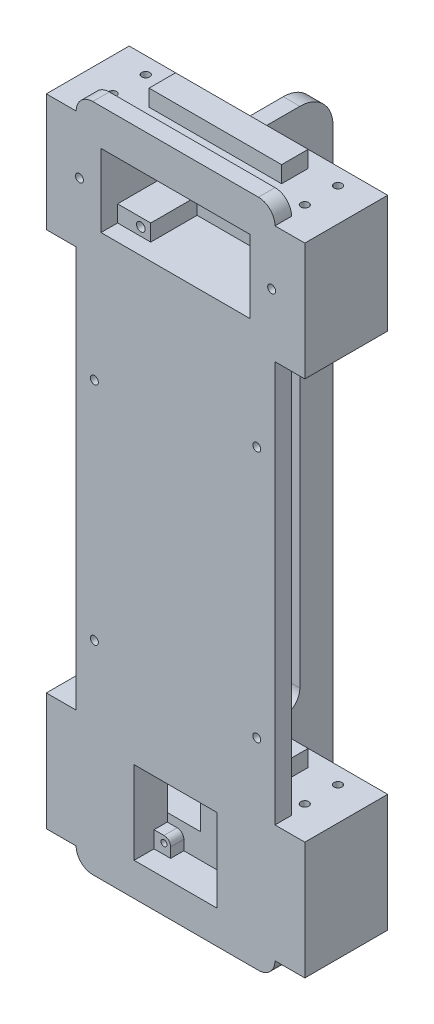
from build123d import *

# Parameters (mm, degrees)
EXTRUDE_1_DEPTH     = 5
SKETCH_3_W          = 78
SKETCH_3_H          = 35.5
EXTRUDE_3_DEPTH     = 25
SKETCH_4_W          = 40
SKETCH_4_H          = 8
EXTRUDE_4_DEPTH     = 5
SKETCH_5_R          = 1.2
CUT_EXTRUDE_1_DEPTH = 210.737222495
SKETCH_6_W          = 40
SKETCH_6_H          = 8
EXTRUDE_5_DEPTH     = 5
EXTRUDE_6_DEPTH     = 2.5
SKETCH_8_W          = 40
SKETCH_8_H          = 8
EXTRUDE_7_DEPTH     = 5
SKETCH_17_W         = 40
SKETCH_17_H         = 8
EXTRUDE_12_DEPTH    = 5
SKETCH_18_W         = 25
SKETCH_18_H         = 25
CUT_EXTRUDE_3_DEPTH = 6
SKETCH_21_R         = 0.9
CUT_EXTRUDE_4_DEPTH = 10
SKETCH_22_R         = 1.2
CUT_EXTRUDE_5_DEPTH = 10
SKETCH_23_W         = 45
SKETCH_23_H         = 22
CUT_EXTRUDE_6_DEPTH = 5
SKETCH_25_R         = 1.3
CUT_EXTRUDE_7_DEPTH = 14
SKETCH_26_W         = 17.5
SKETCH_26_H         = 12
CUT_EXTRUDE_8_DEPTH = 15


with BuildPart() as part:
    # 草图1 → 凸台-拉伸1 (new body)
    with BuildSketch(Plane.XY):
        with BuildLine():
            Line((5, 0), (55, 0))
            ThreePointArc((55, 0), (58.535533906, -1.464466094), (60, -5))
            Line((60, -5), (60, -197.05))
            ThreePointArc((60, -197.05), (58.535533906, -200.585533906), (55, -202.05))
            Line((55, -202.05), (5, -202.05))
            ThreePointArc((5, -202.05), (1.464466094, -200.585533906), (0, -197.05))
            Line((0, -197.05), (0, -5))
            ThreePointArc((0, -5), (1.464466094, -1.464466094), (5, 0))
        make_face()
    extrude(amount=EXTRUDE_1_DEPTH)

    # 草图3 → 凸台-拉伸3 (add)
    with BuildSketch(Plane.XY.offset(5)):
        with Locations((30, -22.75)):
            Rectangle(SKETCH_3_W, SKETCH_3_H)
        with Locations((30, -179.3)):
            Rectangle(SKETCH_3_W, SKETCH_3_H)
    extrude(amount=-EXTRUDE_3_DEPTH)

    # 草图4 → 凸台-拉伸4 (add)
    with BuildSketch(Plane(origin=(0, -5, 0), x_dir=(1, 0, 0), z_dir=(0, 1, 0))):
        with Locations((30, 11)):
            Rectangle(SKETCH_4_W, SKETCH_4_H)
    extrude(amount=EXTRUDE_4_DEPTH)

    # 草图5 → 切除-拉伸1 (cut, through all)
    with BuildSketch(Plane(origin=(0, -5, 0), x_dir=(1, 0, 0), z_dir=(0, 1, 0))):
        with Locations((1, 15)):
            Circle(SKETCH_5_R)
        with Locations((1, 5)):
            Circle(SKETCH_5_R)
        with Locations((59, 5)):
            Circle(SKETCH_5_R)
        with Locations((59, 15)):
            Circle(SKETCH_5_R)
    extrude(amount=-CUT_EXTRUDE_1_DEPTH, mode=Mode.SUBTRACT)

    # 草图6 → 凸台-拉伸5 (add)
    with BuildSketch(Plane.XZ.offset(197.05)):
        with Locations((30, -11)):
            Rectangle(SKETCH_6_W, SKETCH_6_H)
    extrude(amount=EXTRUDE_5_DEPTH)

    # 草图7 → 凸台-拉伸6 (add, symmetric)
    with BuildSketch(Plane(origin=(30, 0, 0), x_dir=(0, 0, -1), z_dir=(1, 0, 0))):
        with BuildLine():
            Line((20, -5), (30, -5))
            ThreePointArc((30, -5), (37.071067812, -7.928932188), (40, -15))
            Line((40, -15), (40, -187.05))
            ThreePointArc((40, -187.05), (37.071067812, -194.121067812), (30, -197.05))
            Line((30, -197.05), (20, -197.05))
            Line((20, -197.05), (20, -162.05))
            Line((20, -162.05), (25, -162.05))
            ThreePointArc((25, -162.05), (28.535533906, -160.585533906), (30, -157.05))
            Line((30, -157.05), (30, -45))
            ThreePointArc((30, -45), (28.535533906, -41.464466094), (25, -40))
            Line((25, -40), (20, -40))
            Line((20, -40), (20, -5))
        make_face()
    extrude(amount=EXTRUDE_6_DEPTH, both=True)

    # 草图8 → 凸台-拉伸7 (add)
    with BuildSketch(Plane(origin=(0, -161.55, 0), x_dir=(1, 0, 0), z_dir=(0, 1, 0))):
        with Locations((30, 11)):
            Rectangle(SKETCH_8_W, SKETCH_8_H)
    extrude(amount=EXTRUDE_7_DEPTH)

    # 草图17 → 凸台-拉伸12 (add)
    with BuildSketch(Plane.XZ.offset(40.5)):
        with Locations((30, -11)):
            Rectangle(SKETCH_17_W, SKETCH_17_H)
    extrude(amount=EXTRUDE_12_DEPTH)

    # 草图18 → 切除-拉伸3 (cut)
    with BuildSketch(Plane.XY.offset(5)):
        with Locations((30, -179.55)):
            Rectangle(SKETCH_18_W, SKETCH_18_H)
    extrude(amount=-CUT_EXTRUDE_3_DEPTH, mode=Mode.SUBTRACT)

    # 草图21 → 切除-拉伸4 (cut)
    with BuildSketch(Plane.XY.offset(5)):
        with Locations((20.5, -170.05)):
            Circle(SKETCH_21_R)
        with Locations((39.5, -170.05)):
            Circle(SKETCH_21_R)
        with Locations((39.5, -189.05)):
            Circle(SKETCH_21_R)
        with Locations((20.5, -189.05)):
            Circle(SKETCH_21_R)
        with BuildLine():
            Line((17.5, -187.05), (20.5, -187.05))
            ThreePointArc((20.5, -187.05), (21.914213562, -187.635786438), (22.5, -189.05))
            Line((22.5, -189.05), (22.5, -192.05))
            Line((22.5, -192.05), (37.5, -192.05))
            Line((37.5, -192.05), (37.5, -189.05))
            ThreePointArc((37.5, -189.05), (38.085786438, -187.635786438), (39.5, -187.05))
            Line((39.5, -187.05), (42.5, -187.05))
            Line((42.5, -187.05), (42.5, -172.05))
            Line((42.5, -172.05), (39.5, -172.05))
            ThreePointArc((39.5, -172.05), (38.085786438, -171.464213562), (37.5, -170.05))
            Line((37.5, -170.05), (37.5, -167.05))
            Line((37.5, -167.05), (22.5, -167.05))
            Line((22.5, -167.05), (22.5, -170.05))
            ThreePointArc((22.5, -170.05), (21.914213562, -171.464213562), (20.5, -172.05))
            Line((20.5, -172.05), (17.5, -172.05))
            Line((17.5, -172.05), (17.5, -187.05))
        make_face()
    extrude(amount=-CUT_EXTRUDE_4_DEPTH, mode=Mode.SUBTRACT)

    # 草图22 → 切除-拉伸5 (cut)
    with BuildSketch(Plane.XY.offset(5)):
        with Locations((5.5, -140.55)):
            Circle(SKETCH_22_R)
        with Locations((54.5, -141.55)):
            Circle(SKETCH_22_R)
        with Locations((5.5, -72.55)):
            Circle(SKETCH_22_R)
        with Locations((54.5, -65.55)):
            Circle(SKETCH_22_R)
        with Locations((1, -22)):
            Circle(SKETCH_22_R)
        with Locations((59, -22)):
            Circle(SKETCH_22_R)
    extrude(amount=-CUT_EXTRUDE_5_DEPTH, mode=Mode.SUBTRACT)

    # 草图23 → 切除-拉伸6 (cut)
    with BuildSketch(Plane.XY.offset(5)):
        with Locations((30, -22)):
            Rectangle(SKETCH_23_W, SKETCH_23_H)
    extrude(amount=-CUT_EXTRUDE_6_DEPTH, mode=Mode.SUBTRACT)

    # 草图25 → 切除-拉伸7 (cut)
    with BuildSketch(Plane.XY):
        with Locations((45.5, -13.5)):
            Circle(SKETCH_25_R)
        with Locations((14.5, -30.5)):
            Circle(SKETCH_25_R)
        Polygon((52.5, -33), (52.5, -16), (42.5, -16), (42.5, -11), (7.5, -11), (7.5, -28), (17.5, -28), (17.5, -33), align=None)
    extrude(amount=-CUT_EXTRUDE_7_DEPTH, mode=Mode.SUBTRACT)

    # 草图26 → 切除-拉伸8 (cut)
    with BuildSketch(Plane(origin=(0, 0, -20), x_dir=(-1, 0, 0), z_dir=(0, 0, -1))):
        with Locations((-41.25, -178.55)):
            Rectangle(SKETCH_26_W, SKETCH_26_H)
        with Locations((-41.25, -22)):
            Rectangle(SKETCH_26_W, SKETCH_26_H)
    cut_extrude_8 = extrude(amount=-CUT_EXTRUDE_8_DEPTH, mode=Mode.SUBTRACT)

    # 镜向1: 切除-拉伸8 across plane
    add(cut_extrude_8.mirror(Plane(origin=(30, 0, 0), x_dir=(0, 0, 1), z_dir=(1, 0, 0))), mode=Mode.SUBTRACT)


solid = part.part
